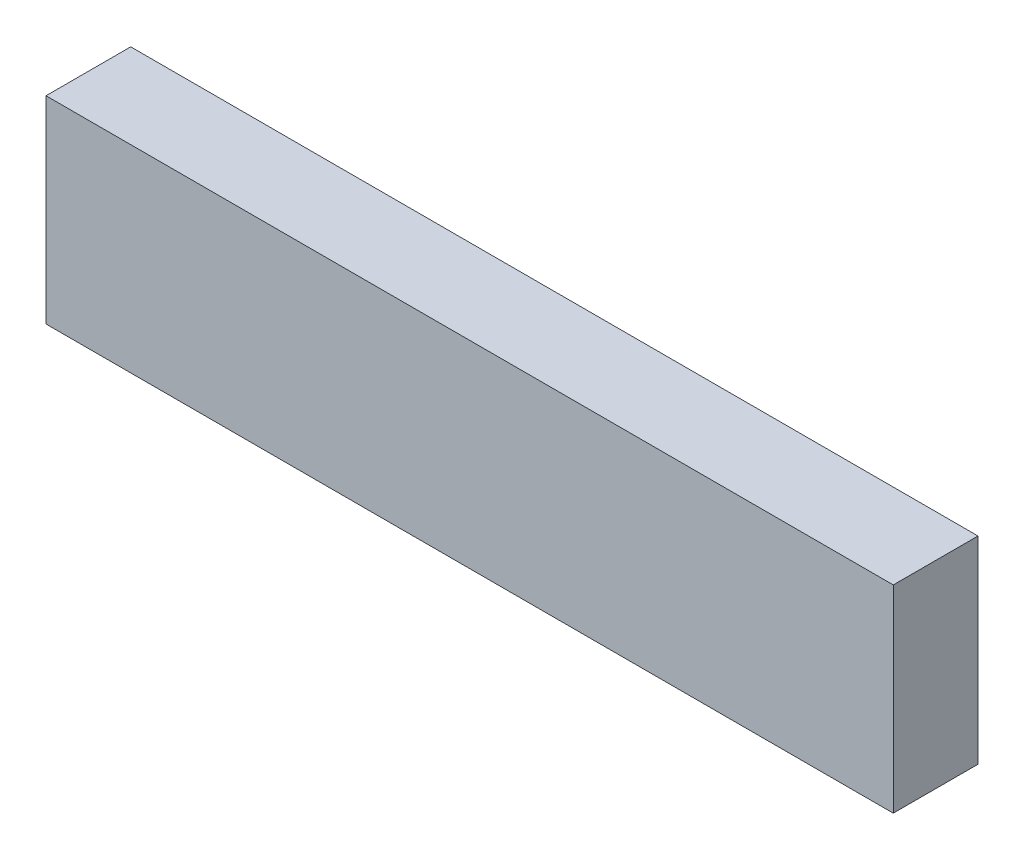
from build123d import *

# Parameters (mm, degrees)
SKETCH_1_W      = 300
SKETCH_1_H      = 70
EXTRUDE_1_DEPTH = 30


with BuildPart() as part:
    # 草图1 → 凸台-拉伸1 (new body)
    with BuildSketch(Plane.XY):
        Rectangle(SKETCH_1_W, SKETCH_1_H)
    extrude(amount=EXTRUDE_1_DEPTH)


solid = part.part
